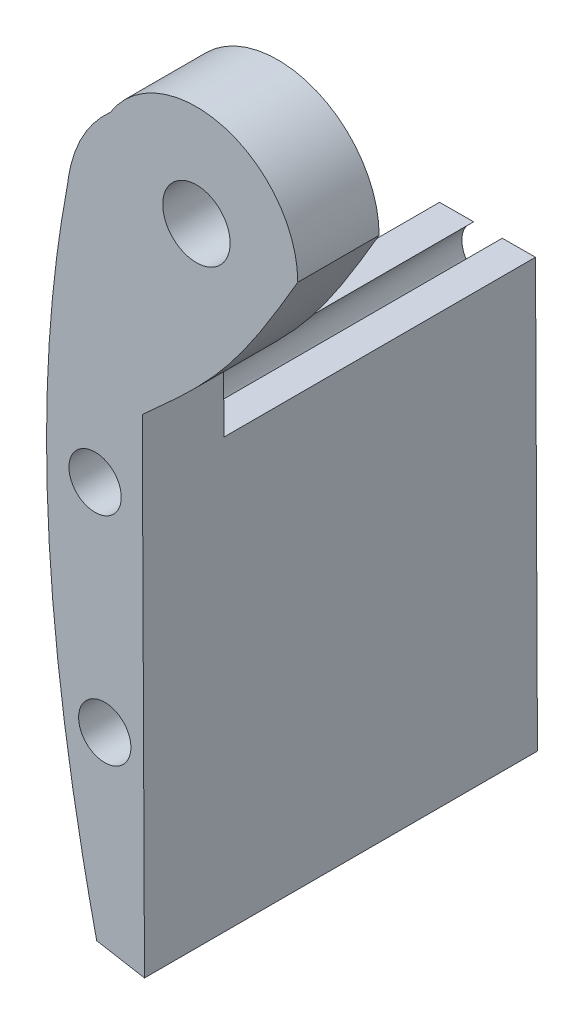
from build123d import *

# Parameters (mm, degrees)
SKETCH1_R           = 2.9
BOSS_EXTRUDE1_DEPTH = 7
BOSS_EXTRUDE2_DEPTH = 26.812432
SKETCH3_R           = 2.25
CUT_EXTRUDE1_DEPTH  = 81.286678341


with BuildPart() as part:
    # Sketch1 → Boss-Extrude1 (new body)
    with BuildSketch(Plane.XY):
        with BuildLine():
            Line((-14.153385189, -69.716871134), (-10.039841479, -70.438427685))
            Line((-10.039841479, -70.438427685), (-10.231600818, -28.548135162))
            add(Edge.make_bspline(
                [(3.150526507, -12), (1.121426745, -15.448537633), (-2.522354698, -21.641292501), (-7.864373324, -26.42729642), (-10.231600818, -28.548135162)],
                knots=[0, 0, 0, 0, 0.556866484, 1, 1, 1, 1], degree=3))
            ThreePointArc((3.150526507, -12), (-3.18362895, -3.611112101), (-12.986183722, -7.406488955))
            add(Edge.make_bspline(
                [(-16.663916234, -14.630806425), (-16.157795835, -10.23676377), (-12.986183722, -7.406488955)],
                knots=[0, 0, 0, 1, 1, 1], degree=2))
            add(Edge.make_bspline(
                [(-16.663916234, -14.630806425), (-17.667702323, -19.881251045), (-18.220131563, -25.189037493), (-18.401311599, -30.514562532)],
                knots=[0, 0, 0, 0, 0.288118642, 0.288118642, 0.288118642, 0.288118642], degree=3))
            add(Edge.make_bspline(
                [(-18.401311599, -30.514562532), (-18.848969857, -43.672829442), (-17.03022033, -56.93938717), (-14.153385189, -69.716871134)],
                knots=[0.288118642, 0.288118642, 0.288118642, 0.288118642, 1, 1, 1, 1], degree=3))
        make_face()
        with Locations((-5.571628032, -12)):
            Circle(SKETCH1_R, mode=Mode.SUBTRACT)
    extrude(amount=-BOSS_EXTRUDE1_DEPTH)

    # Sketch2 → Boss-Extrude2 (add)
    with BuildSketch(Plane(origin=(0, 0, -7), x_dir=(-1, 0, 0), z_dir=(0, 0, -1))):
        with BuildLine():
            Line((10.039841479, -70.438427685), (14.153385189, -69.716871134))
            add(Edge.make_bspline(
                [(14.153385189, -69.716871134), (16.794208846, -57.987633874), (18.543433317, -45.846277061), (18.466393507, -33.754875992)],
                knots=[0.346520381, 0.346520381, 0.346520381, 0.346520381, 1, 1, 1, 1], degree=3))
            Line((18.466393507, -33.754875992), (15.532606101, -33.741446123))
            ThreePointArc((15.532606101, -33.741446123), (14.280806546, -37.867902739), (13.066837656, -33.730158684))
            Line((13.066837656, -33.730158684), (10.207939206, -33.717071631))
            Line((10.207939206, -33.717071631), (10.039841479, -70.438427685))
        make_face()
    extrude(amount=BOSS_EXTRUDE2_DEPTH)

    # Sketch3 → Cut-Extrude1 (cut, through all)
    with BuildSketch(Plane.XY):
        with Locations((-14.291106163, -35.617926313)):
            Circle(SKETCH3_R)
        with Locations((-13.459661862, -53.850312066)):
            Circle(SKETCH3_R)
    extrude(amount=-CUT_EXTRUDE1_DEPTH, mode=Mode.SUBTRACT)


solid = part.part
